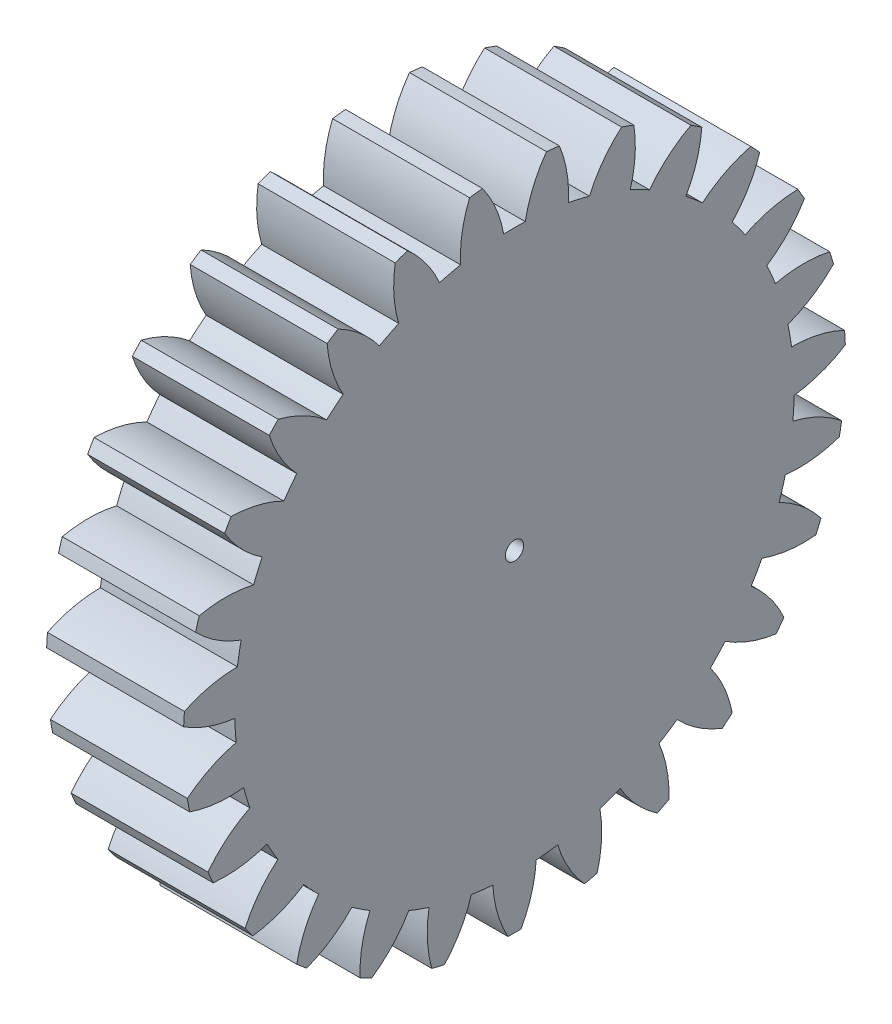
from build123d import *

# Parameters (mm, degrees)
BASPROSKE_W     = 6
BASPROSKE_H     = 14.5
TOOTHCUT_DEPTH  = 22.365860619
TEETHCUTS_COUNT = 27
TEETHCUTS_ANGLE = 346.666666667
BORSKE_R        = 0.4
BORE_DEPTH      = 50.0000508


with BuildPart() as part:
    # BasProSke → Base-Revolve (revolve)
    with BuildSketch(Plane(origin=(0, 0, 0), x_dir=(1, 0, 0), z_dir=(0, 1, 0)), mode=Mode.PRIVATE) as base_revolve_sk:
        with Locations((3, 7.25)):
            Rectangle(BASPROSKE_W, BASPROSKE_H)
    revolve(base_revolve_sk.sketch.rotate(Axis((-10, 0, 0), (1, 0, 0)), 180), axis=Axis((-10, 0, 0), (1, 0, 0)))

    # TooCutSke → ToothCut (cut, through all)
    with BuildSketch(Plane(origin=(0, 0, 0), x_dir=(0, 0, -1), z_dir=(1, 0, 0))):
        with BuildLine():
            ThreePointArc((0.474054864, 12.239823242), (0, 12.249), (-0.474054864, 12.239823242))
            ThreePointArc((-0.474054864, 12.239823242), (-0.820231692, 13.40120918), (-1.416685779, 14.456149092))
            ThreePointArc((-1.416685779, 14.456149092), (0, 14.5254), (1.416685779, 14.456149092))
            ThreePointArc((1.416685779, 14.456149092), (0.820231692, 13.40120918), (0.474054864, 12.239823242))
        make_face()
    toothcut = extrude(amount=TOOTHCUT_DEPTH, mode=Mode.SUBTRACT)

    # TeethCuts: ToothCut ×27 about axis
    teethcuts_axis = Axis((-10, 0, 0), (1, 0, 0))
    for i in range(1, TEETHCUTS_COUNT):
        add(toothcut.rotate(teethcuts_axis, i * TEETHCUTS_ANGLE / (TEETHCUTS_COUNT - 1)), mode=Mode.SUBTRACT)

    # BorSke → Bore (cut, symmetric)
    with BuildSketch(Plane(origin=(0, 0, 0), x_dir=(0, 0, -1), z_dir=(1, 0, 0))):
        with Locations(Location((0, 0, 0), (0, 0, 180))):
            Circle(BORSKE_R)
    extrude(amount=BORE_DEPTH, both=True, mode=Mode.SUBTRACT)


solid = part.part
